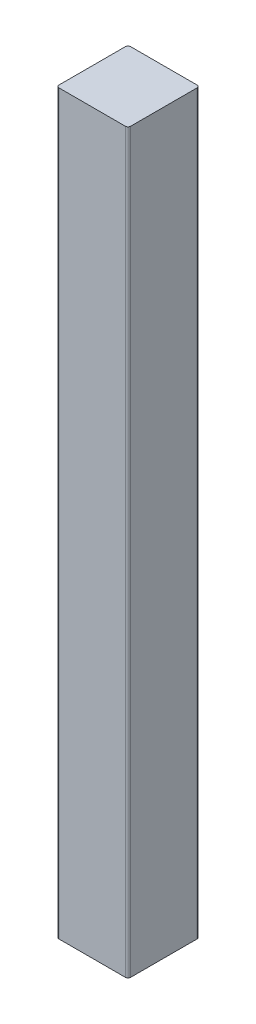
from build123d import *

# Parameters (mm, degrees)
SKETCH1_W           = 88.9
SKETCH1_H           = 88.9
BOSS_EXTRUDE1_DEPTH = 915.9875
FILLET1_R           = 3.175


with BuildPart() as part:
    # Sketch1 → Boss-Extrude1 (new body)
    with BuildSketch(Plane(origin=(0, 0, 0), x_dir=(1, 0, 0), z_dir=(0, 1, 0))):
        Rectangle(SKETCH1_W, SKETCH1_H)
    extrude(amount=BOSS_EXTRUDE1_DEPTH)

    # Fillet1
    fillet1_edges = [part.edges().sort_by_distance(p)[0] for p in [
        (44.45, 457.99375, 44.45),
        (-44.45, 457.99375, 44.45),
        (-44.45, 457.99375, -44.45),
        (44.45, 457.99375, -44.45),
    ]]
    fillet(fillet1_edges, radius=FILLET1_R)


solid = part.part
